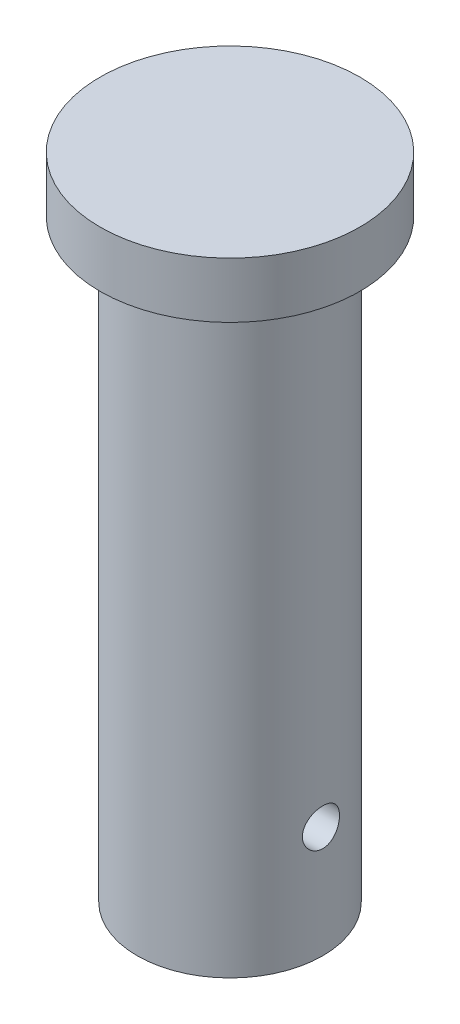
from build123d import *

# Parameters (mm, degrees)
SKETCH2_R          = 5
CUT_EXTRUDE1_DEPTH = 189.281703838


with BuildPart() as part:
    # Sketch1 → Revolve1 (revolve)
    with BuildSketch(Plane.XY, mode=Mode.PRIVATE) as revolve1_sk:
        Polygon((0, 0), (0, 175), (35, 175), (35, 160), (25, 160), (25, 0), align=None)
    revolve(revolve1_sk.sketch.rotate(Axis((0, 0, 0), (0, 1, 0)), 90), axis=Axis((0, 0, 0), (0, 1, 0)))

    # Sketch2 → Cut-Extrude1 (cut, through all)
    with BuildSketch(Plane(origin=(25, 0, 0), x_dir=(0, 0, -1), z_dir=(1, 0, 0))):
        with Locations((0, 30)):
            Circle(SKETCH2_R)
    extrude(amount=-CUT_EXTRUDE1_DEPTH, mode=Mode.SUBTRACT)


solid = part.part
